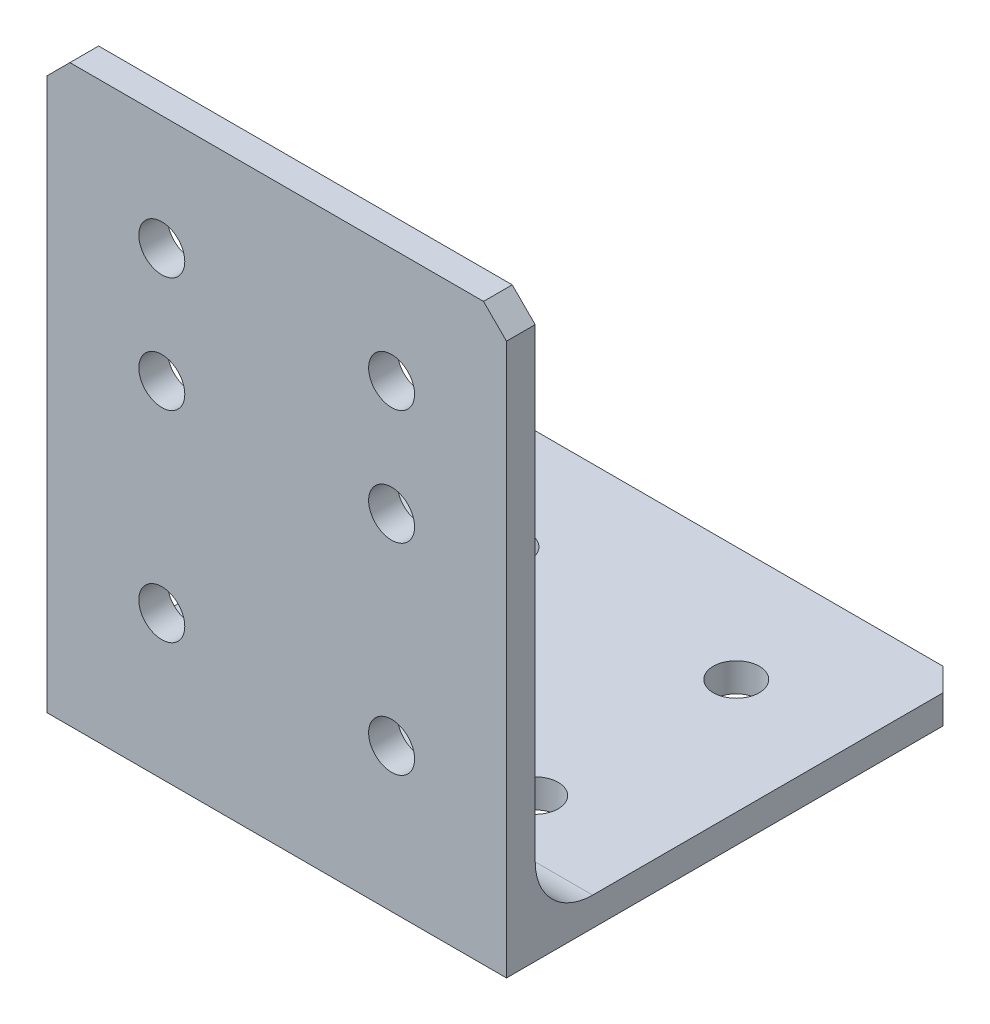
from build123d import *

# Parameters (mm, degrees)
BOSS_EXTRUDE1_DEPTH = 50.8
SKETCH2_R           = 2.54
CUT_EXTRUDE1_DEPTH  = 96.882897328
SKETCH3_R           = 2.54
CUT_EXTRUDE2_DEPTH  = 96.882897328
FILLET1_R           = 6.35
CHAMFER1_SIZE       = 2.54


with BuildPart() as part:
    # Sketch1 → Boss-Extrude1 (new body)
    with BuildSketch(Plane(origin=(0, 0, 0), x_dir=(0, 0, -1), z_dir=(1, 0, 0))):
        Polygon((0, 0), (0, 63.5), (3.175, 63.5), (3.175, 3.175), (50.8, 3.175), (50.8, 0), align=None)
    extrude(amount=BOSS_EXTRUDE1_DEPTH)

    # Sketch2 → Cut-Extrude1 (cut, through all)
    with BuildSketch(Plane.XY):
        with Locations((12.7, 38.1)):
            Circle(SKETCH2_R)
        with Locations((12.7, 15.875)):
            Circle(SKETCH2_R)
        with Locations((12.7, 50.8)):
            Circle(SKETCH2_R)
        with Locations(Location((38.1, 50.8, 0), (0, 0, 270))):
            Circle(SKETCH2_R)
        with Locations(Location((38.1, 15.875, 0), (0, 0, 270))):
            Circle(SKETCH2_R)
        with Locations(Location((38.1, 38.1, 0), (0, 0, 270))):
            Circle(SKETCH2_R)
    extrude(amount=-CUT_EXTRUDE1_DEPTH, mode=Mode.SUBTRACT)

    # Sketch3 → Cut-Extrude2 (cut, through all)
    with BuildSketch(Plane.XZ):
        with Locations(Location((38.1, -38.1, 0), (0, 0, 270))):
            Circle(SKETCH3_R)
        with Locations(Location((38.1, -15.875, 0), (0, 0, 270))):
            Circle(SKETCH3_R)
        with Locations(Location((12.7, -38.1, 0), (0, 0, 270))):
            Circle(SKETCH3_R)
        with Locations(Location((12.7, -15.875, 0), (0, 0, 270))):
            Circle(SKETCH3_R)
    extrude(amount=-CUT_EXTRUDE2_DEPTH, mode=Mode.SUBTRACT)

    # Fillet1
    fillet1_edges = [part.edges().sort_by_distance(p)[0] for p in [
        (25.4, 3.175, -3.175),
    ]]
    fillet(fillet1_edges, radius=FILLET1_R)

    # Chamfer1
    chamfer1_edges = [part.edges().sort_by_distance(p)[0] for p in [
        (50.8, 63.5, -1.5875),
        (0, 63.5, -1.5875),
        (0, 1.5875, -50.8),
        (50.8, 1.5875, -50.8),
    ]]
    chamfer(chamfer1_edges, length=CHAMFER1_SIZE)


solid = part.part
